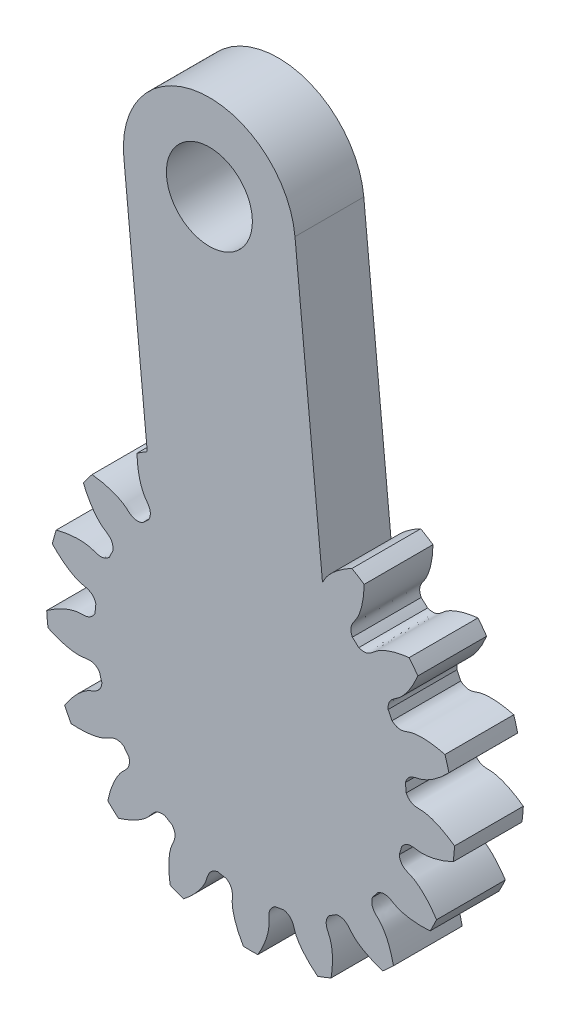
from build123d import *

# Parameters (mm, degrees)
SKETCH_1_R               = 11.875
EXTRUDE_1_DEPTH          = 4
CUT_EXTRUDE_1_DEPTH      = 18.26358161
PATTERN_CIRCULAR_1_COUNT = 17
SKETCH_4_R               = 2.5
EXTRUDE_2_DEPTH          = 4


with BuildPart() as part:
    # 草图1 → 凸台-拉伸1 (new body)
    with BuildSketch(Plane.XY):
        Circle(SKETCH_1_R)
    extrude(amount=EXTRUDE_1_DEPTH)

    # 草图2 → 切除-拉伸1 (cut, through all)
    with BuildSketch(Plane.XY):
        with BuildLine():
            ThreePointArc((0.252117184, 9.058992393), (0, 9.0625), (-0.252117184, 9.058992393))
            add(Edge.make_bspline(
                [(-0.252117184, 9.058992393), (-0.784849676, 9.281027527), (-0.707744223, 9.693516758), (-0.797882006, 10.081030172), (-0.806219668, 10.113938244), (-0.816273128, 10.150524142), (-0.828188237, 10.190731666), (-0.842114722, 10.234499204), (-0.858198849, 10.281760947), (-0.876585557, 10.332446564), (-0.89741764, 10.386481367), (-0.920835849, 10.44378633), (-0.946978705, 10.50427815), (-0.975982409, 10.567869301), (-1.00798072, 10.634468101), (-1.043104844, 10.703978769), (-1.081483327, 10.776301493), (-1.123241944, 10.8513325), (-1.168503594, 10.928964125), (-1.217388193, 11.009084888), (-1.270012572, 11.091579568), (-1.326490375, 11.176329284), (-1.386931961, 11.263211578), (-1.451444306, 11.352100494), (-1.520130907, 11.442866674), (-1.59309169, 11.535377437), (-1.670422919, 11.629496879), (-1.752217104, 11.725085962), (-1.838562921, 11.822002612), (-1.929545124, 11.920101818), (-2.025244463, 12.019235731), (-2.125737604, 12.119253766), (-2.231097057, 12.22000271), (-2.341391099, 12.321326825), (-2.456683699, 12.423067957), (-2.577034457, 12.525065649), (-2.702498531, 12.627157249), (-2.833126576, 12.72917803), (-2.968964686, 12.830961296), (-3.11005433, 12.932338508), (-3.256432309, 13.033139399), (-3.408130668, 13.133192093), (-3.619777043, 13.266788167), (-3.783221128, 13.363157464), (-3.894557291, 13.425898898)],
                knots=[0, 0, 0, 0, 0.193882922, 0.199023975, 0.204850501, 0.211362501, 0.218559975, 0.226442923, 0.235011345, 0.24426524, 0.254204608, 0.264829451, 0.276139767, 0.288135557, 0.300816821, 0.314183558, 0.328235769, 0.342973453, 0.358396612, 0.374505244, 0.39129935, 0.408778929, 0.426943982, 0.445794509, 0.46533051, 0.485551984, 0.506458932, 0.528051354, 0.550329249, 0.573292619, 0.596941461, 0.621275778, 0.646295568, 0.672000832, 0.69839157, 0.725467781, 0.753229466, 0.781676625, 0.810809257, 0.840627364, 0.871130943, 0.902319997, 0.934194524, 1, 1, 1, 1], degree=3))
            ThreePointArc((-3.894557291, 13.425898898), (0, 13.979353981), (3.894557291, 13.425898898))
            add(Edge.make_bspline(
                [(0.252117184, 9.058992393), (0.784849676, 9.281027527), (0.707744223, 9.693516758), (0.797882006, 10.081030172), (0.806219668, 10.113938244), (0.816273128, 10.150524142), (0.828188237, 10.190731666), (0.842114722, 10.234499204), (0.858198849, 10.281760947), (0.876585557, 10.332446564), (0.89741764, 10.386481367), (0.920835849, 10.44378633), (0.946978705, 10.50427815), (0.975982409, 10.567869301), (1.00798072, 10.634468101), (1.043104844, 10.703978769), (1.081483327, 10.776301493), (1.123241944, 10.8513325), (1.168503594, 10.928964125), (1.217388193, 11.009084888), (1.270012572, 11.091579568), (1.326490375, 11.176329284), (1.386931961, 11.263211578), (1.451444306, 11.352100494), (1.520130907, 11.442866674), (1.59309169, 11.535377437), (1.670422919, 11.629496879), (1.752217104, 11.725085962), (1.838562921, 11.822002612), (1.929545124, 11.920101818), (2.025244463, 12.019235731), (2.125737604, 12.119253766), (2.231097057, 12.22000271), (2.341391099, 12.321326825), (2.456683699, 12.423067957), (2.577034457, 12.525065649), (2.702498531, 12.627157249), (2.833126576, 12.72917803), (2.968964686, 12.830961296), (3.11005433, 12.932338508), (3.256432309, 13.033139399), (3.408130668, 13.133192093), (3.619777043, 13.266788167), (3.783221128, 13.363157464), (3.894557291, 13.425898898)],
                knots=[0, 0, 0, 0, 0.193882922, 0.199023975, 0.204850501, 0.211362501, 0.218559975, 0.226442923, 0.235011345, 0.24426524, 0.254204608, 0.264829451, 0.276139767, 0.288135557, 0.300816821, 0.314183558, 0.328235769, 0.342973453, 0.358396612, 0.374505244, 0.39129935, 0.408778929, 0.426943982, 0.445794509, 0.46533051, 0.485551984, 0.506458932, 0.528051354, 0.550329249, 0.573292619, 0.596941461, 0.621275778, 0.646295568, 0.672000832, 0.69839157, 0.725467781, 0.753229466, 0.781676625, 0.810809257, 0.840627364, 0.871130943, 0.902319997, 0.934194524, 1, 1, 1, 1], degree=3))
        make_face()
    cut_extrude_1 = extrude(amount=CUT_EXTRUDE_1_DEPTH, mode=Mode.SUBTRACT)

    # 阵列(圆周)1: 切除-拉伸1 ×17 about axis
    pattern_circular_1_axis = Axis((0, 0, -0.1), (0, 0, 1))
    for i in range(1, PATTERN_CIRCULAR_1_COUNT):
        add(cut_extrude_1.rotate(pattern_circular_1_axis, i * 360 / PATTERN_CIRCULAR_1_COUNT), mode=Mode.SUBTRACT)

    # 草图4 → 凸台-拉伸2 (add)
    with BuildSketch(Plane.XY.offset(4)):
        with BuildLine():
            Line((-4.976980992, -0.479228763), (-7.373124805, 24.405676197))
            ThreePointArc((-7.373124805, 24.405676197), (-2.875372576, 29.861885951), (2.580837179, 25.364133722))
            Line((2.580837179, 25.364133722), (4.976980992, 0.479228763))
            ThreePointArc((4.976980992, 0.479228763), (0.479228763, -4.976980992), (-4.976980992, -0.479228763))
        make_face()
        with Locations((-2.396143813, 24.884904959)):
            Circle(SKETCH_4_R, mode=Mode.SUBTRACT)
    extrude(amount=-EXTRUDE_2_DEPTH)


solid = part.part
